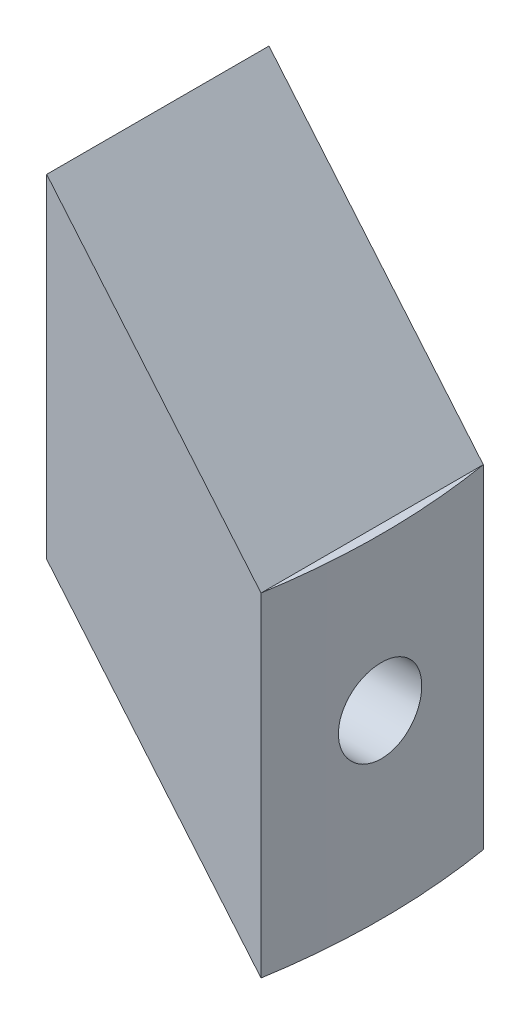
from build123d import *

# Parameters (mm, degrees)
BOSS_EXTRUDE4_DEPTH = 12.7
BOSS_EXTRUDE5_DEPTH = 19.05
SKETCH7_W           = 12.7
SKETCH7_H           = 4.7625


with BuildPart() as part:
    # Sketch5 → Boss-Extrude4 (new, symmetric)
    with BuildSketch(Plane.XY):
        Polygon((0, -19.05), (0, 19.05), (-24.490207929, 48.236293283), (-24.490207929, 10.136293283), align=None)
    extrude(amount=BOSS_EXTRUDE4_DEPTH, both=True)

    # Sketch6 → Boss-Extrude5 (add, symmetric)
    with BuildSketch(Plane(origin=(0, 0, 0), x_dir=(1, 0, 0), z_dir=(0, 1, 0))):
        with BuildLine():
            Line((0, 12.7), (0, -12.7))
            ThreePointArc((0, -12.7), (1.051084135, 0), (0, 12.7))
        make_face()
    extrude(amount=BOSS_EXTRUDE5_DEPTH, both=True)

    # Sketch7 → Cut-Revolve5 (revolve, cut)
    with BuildSketch(Plane.XY, mode=Mode.PRIVATE) as cut_revolve5_sk:
        with Locations((-5.298915865, 3.96875)):
            Rectangle(SKETCH7_W, SKETCH7_H)
    revolve(cut_revolve5_sk.sketch.rotate(Axis((-31.455592934, 1.5875, 0), (1, 0, 0)), 180), axis=Axis((-31.455592934, 1.5875, 0), (1, 0, 0)), mode=Mode.SUBTRACT)


solid = part.part
